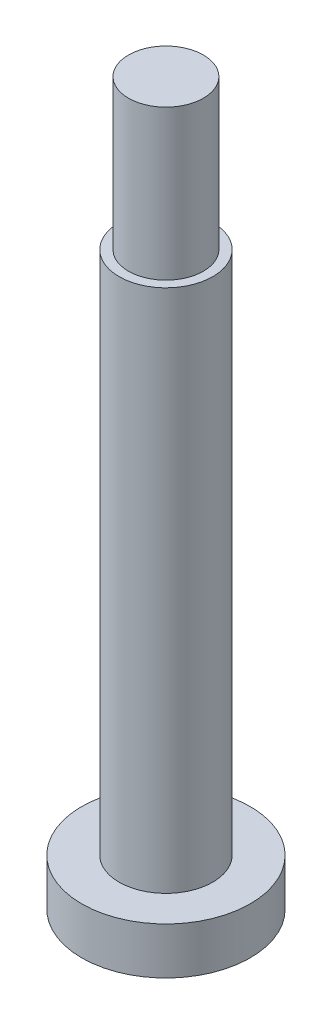
from build123d import *

# Parameters (mm, degrees)
SKETCH_1_R      = 4.5
EXTRUDE_1_DEPTH = 2.5
SKETCH_2_R      = 2.5
EXTRUDE_2_DEPTH = 28
SKETCH_3_R      = 2
EXTRUDE_3_DEPTH = 8


with BuildPart() as part:
    # 草图1 → 凸台-拉伸1 (new body)
    with BuildSketch(Plane(origin=(0, 0, 0), x_dir=(1, 0, 0), z_dir=(0, 1, 0))):
        with Locations(Location((0, 0, 0), (0, 0, 270))):
            Circle(SKETCH_1_R)
    extrude(amount=EXTRUDE_1_DEPTH)

    # 草图2 → 凸台-拉伸2 (add)
    with BuildSketch(Plane(origin=(0, 2.5, 0), x_dir=(1, 0, 0), z_dir=(0, 1, 0))):
        with Locations(Location((0, 0, 0), (0, 0, 270))):
            Circle(SKETCH_2_R)
    extrude(amount=EXTRUDE_2_DEPTH)

    # 草图3 → 凸台-拉伸3 (add)
    with BuildSketch(Plane(origin=(0, 30.5, 0), x_dir=(1, 0, 0), z_dir=(0, 1, 0))):
        with Locations(Location((0, 0, 0), (0, 0, 270))):
            Circle(SKETCH_3_R)
    extrude(amount=EXTRUDE_3_DEPTH)


solid = part.part
